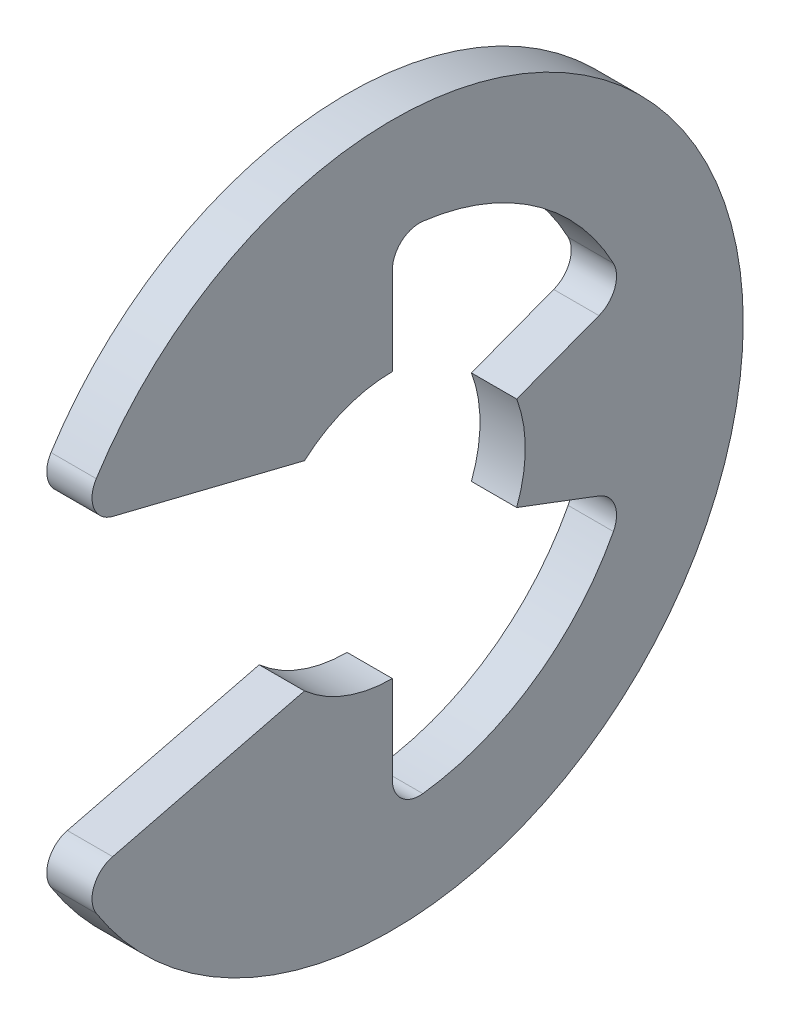
from build123d import *

# Parameters (mm, degrees)
EXTRUDE1_DEPTH = 0.35
FILLET1_R      = 0.42


with BuildPart() as part:
    # Sketch1 → Extrude1 (new, symmetric)
    with BuildSketch(Plane(origin=(0, 0, 0), x_dir=(0, 0, -1), z_dir=(1, 0, 0))):
        with BuildLine():
            Line((-4.860103887, -2.410397313), (-1.359254736, -1.54125))
            ThreePointArc((-1.359254736, -1.54125), (-0.726552218, -1.922276482), (0, -2.055))
            Line((0, -2.055), (0, -3.860645161))
            ThreePointArc((0, -3.860645161), (2.194882217, -3.176015289), (3.611302871, -1.364944187))
            Line((3.611302871, -1.364944187), (1.922276482, -0.726552218))
            ThreePointArc((1.922276482, -0.726552218), (2.055, 0), (1.922276482, 0.726552218))
            Line((1.922276482, 0.726552218), (3.611302871, 1.364944187))
            ThreePointArc((3.611302871, 1.364944187), (2.194882217, 3.176015289), (0, 3.860645161))
            Line((0, 3.860645161), (0, 2.055))
            ThreePointArc((0, 2.055), (-0.726552218, 1.922276482), (-1.359254736, 1.54125))
            Line((-1.359254736, 1.54125), (-4.860103887, 2.410397313))
            ThreePointArc((-4.860103887, 2.410397313), (5.425, 0), (-4.860103887, -2.410397313))
        make_face()
    extrude(amount=EXTRUDE1_DEPTH, both=True)

    # Fillet1
    fillet1_edges = [part.edges().sort_by_distance(p)[0] for p in [
        (0, -2.410397313, 4.860103887),
        (0, -3.860645161, 0),
        (0, -1.364944187, -3.611302871),
        (0, 1.364944187, -3.611302871),
        (0, 3.860645161, 0),
        (0, 2.410397313, 4.860103887),
    ]]
    fillet(fillet1_edges, radius=FILLET1_R)


solid = part.part
